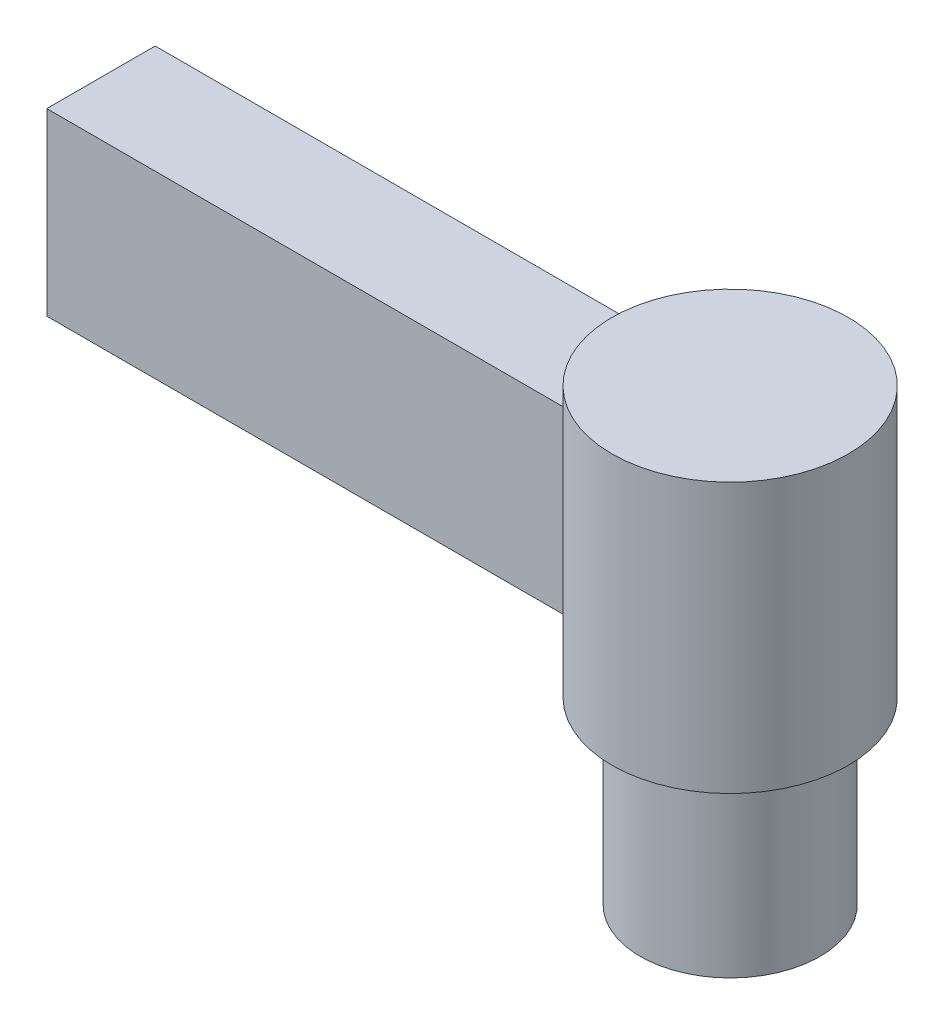
from build123d import *

# Parameters (mm, degrees)
SKETCH5_R           = 1
BOSS_EXTRUDE2_DEPTH = 2
SKETCH8_R           = 1.315386289
BOSS_EXTRUDE4_DEPTH = 3
SKETCH11_W          = 1.206172966
SKETCH11_H          = 2
BOSS_EXTRUDE5_DEPTH = 7


with BuildPart() as part:
    # Sketch5 → Boss-Extrude2 (new body)
    with BuildSketch(Plane.XZ.offset(-9.339266183)):
        with Locations(Location((0, 0, 0), (0, 0, 270))):
            Circle(SKETCH5_R)
    extrude(amount=-BOSS_EXTRUDE2_DEPTH)

    # Sketch8 → Boss-Extrude4 (add)
    with BuildSketch(Plane(origin=(0, 11.339266183, 0), x_dir=(1, 0, 0), z_dir=(0, 1, 0))):
        with Locations(Location((0, 0, 0), (0, 0, 270))):
            Circle(SKETCH8_R)
    extrude(amount=BOSS_EXTRUDE4_DEPTH)

    # Sketch11 → Boss-Extrude5 (add)
    with BuildSketch(Plane(origin=(0, 0, 0), x_dir=(0, 0, -1), z_dir=(1, 0, 0))):
        with Locations((0, 12.810409413)):
            Rectangle(SKETCH11_W, SKETCH11_H)
    extrude(amount=-BOSS_EXTRUDE5_DEPTH)


solid = part.part
